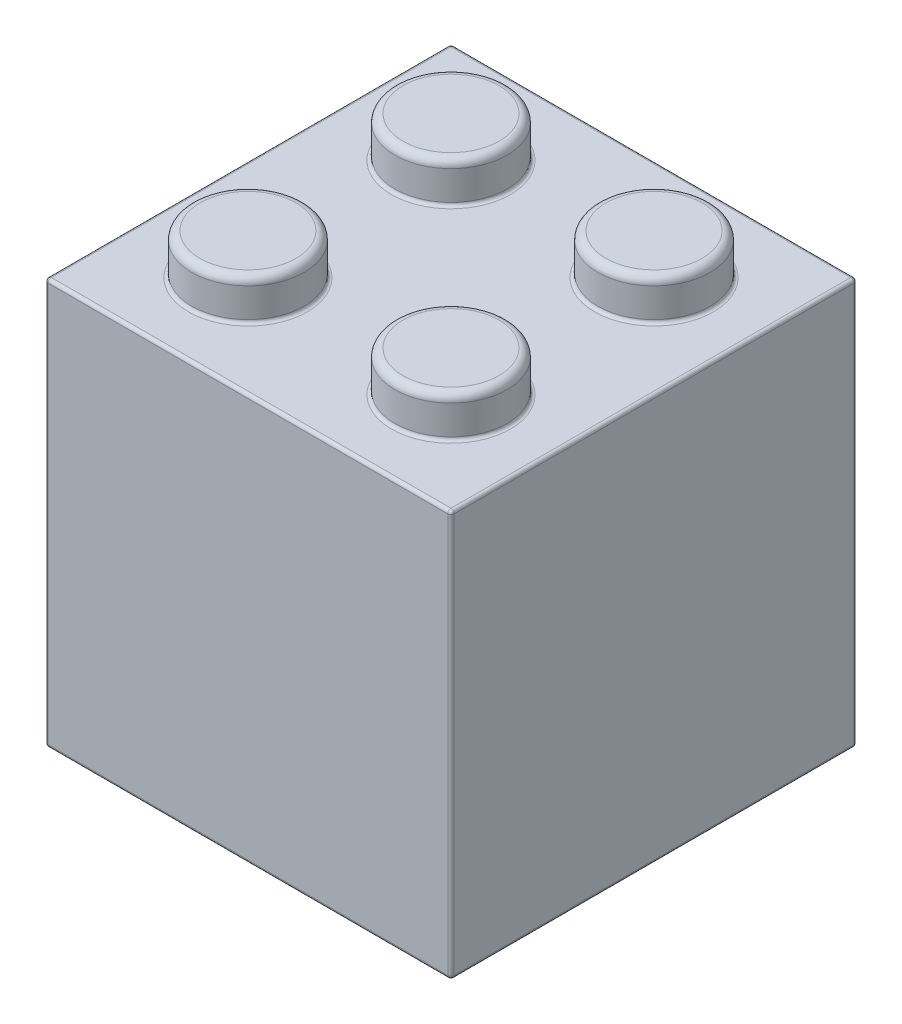
from build123d import *

# Parameters (mm, degrees)
SKETCH1_W           = 10
SKETCH1_H           = 10
BOX_DEPTH           = 10
SKETCH2_W           = 9
SKETCH2_H           = 9
CUT_EXTRUDE1_DEPTH  = 9.5
SKETCH3_R           = 1.384081264
PINS_DEPTH          = 1
SKETCH4_R           = 2.151452642
BOSS_EXTRUDE3_DEPTH = 9.45482151
SKETCH5_R           = 1.8
CUT_EXTRUDE2_DEPTH  = 9.5
SKETCH6_R           = 1.086370505
CUT_EXTRUDE3_DEPTH  = 1
BOSS_EXTRUDE4_DEPTH = 9.5
FILLET5_R           = 0.2
FILLET6_R           = 0.08


with BuildPart() as part:
    # Sketch1 → box (new body)
    with BuildSketch(Plane(origin=(0, 0, 0), x_dir=(1, 0, 0), z_dir=(0, 1, 0))):
        with Locations((-3.342652458, 0.57322318)):
            Rectangle(SKETCH1_W, SKETCH1_H)
    extrude(amount=BOX_DEPTH)

    # Sketch2 → Cut-Extrude1 (cut)
    with BuildSketch(Plane.XZ):
        with Locations((-3.342652458, -0.57322318)):
            Rectangle(SKETCH2_W, SKETCH2_H)
    extrude(amount=-CUT_EXTRUDE1_DEPTH, mode=Mode.SUBTRACT)

    # Sketch3 → pins (add)
    with BuildSketch(Plane(origin=(0, 10, 0), x_dir=(1, 0, 0), z_dir=(0, 1, 0))):
        with Locations(Location((-5.842652458, 3.07322318, 0), (0, 0, 270))):
            Circle(SKETCH3_R)
        with Locations(Location((-0.842652458, 3.07322318, 0), (0, 0, 270))):
            Circle(SKETCH3_R)
        with Locations(Location((-0.842652458, -1.92677682, 0), (0, 0, 270))):
            Circle(SKETCH3_R)
        with Locations(Location((-5.842652458, -1.92677682, 0), (0, 0, 270))):
            Circle(SKETCH3_R)
    extrude(amount=PINS_DEPTH)

    # Sketch4 → Boss-Extrude3 (add)
    with BuildSketch(Plane.XZ.offset(-9.5)):
        with Locations(Location((-3.342652458, -0.57322318, 0), (0, 0, 270))):
            Circle(SKETCH4_R)
    extrude(amount=BOSS_EXTRUDE3_DEPTH)

    # Sketch5 → Cut-Extrude2 (cut)
    with BuildSketch(Plane.XZ.offset(-0.04517849)):
        with Locations(Location((-3.342652458, -0.57322318, 0), (0, 0, 270))):
            Circle(SKETCH5_R)
    extrude(amount=-CUT_EXTRUDE2_DEPTH, mode=Mode.SUBTRACT)

    # Sketch6 → Cut-Extrude3 (cut)
    with BuildSketch(Plane.XZ.offset(-9.5)):
        with Locations(Location((-5.842652458, 1.92677682, 0), (0, 0, 270))):
            Circle(SKETCH6_R)
        with Locations(Location((-0.842652458, 1.92677682, 0), (0, 0, 270))):
            Circle(SKETCH6_R)
        with Locations(Location((-0.842652458, -3.07322318, 0), (0, 0, 270))):
            Circle(SKETCH6_R)
        with Locations(Location((-5.842652458, -3.07322318, 0), (0, 0, 270))):
            Circle(SKETCH6_R)
    extrude(amount=-CUT_EXTRUDE3_DEPTH, mode=Mode.SUBTRACT)

    # Sketch8 → Boss-Extrude4 (add)
    with BuildSketch(Plane.XZ.offset(-9.5)):
        with BuildLine():
            Line((-6.026662526, 3.92677682), (-5.15864239, 3.92677682))
            ThreePointArc((-5.15864239, 3.92677682), (-5.592652458, 3.492766752), (-6.026662526, 3.92677682))
        make_face()
        with BuildLine():
            Line((-7.842652458, 2.110786889), (-7.842652458, 1.242766752))
            ThreePointArc((-7.842652458, 1.242766752), (-7.40864239, 1.67677682), (-7.842652458, 2.110786889))
        make_face()
        with BuildLine():
            Line((-0.65864239, -5.07322318), (-1.526662526, -5.07322318))
            ThreePointArc((-1.526662526, -5.07322318), (-1.092652458, -4.639213111), (-0.65864239, -5.07322318))
        make_face()
        with BuildLine():
            Line((1.157347542, -3.257233248), (1.157347542, -2.389213111))
            ThreePointArc((1.157347542, -2.389213111), (0.723337474, -2.82322318), (1.157347542, -3.257233248))
        make_face()
        with BuildLine():
            Line((-6.026662526, -5.07322318), (-5.15864239, -5.07322318))
            ThreePointArc((-5.15864239, -5.07322318), (-5.592652458, -4.639213111), (-6.026662526, -5.07322318))
        make_face()
        with BuildLine():
            Line((-7.842652458, -3.257233248), (-7.842652458, -2.389213111))
            ThreePointArc((-7.842652458, -2.389213111), (-7.40864239, -2.82322318), (-7.842652458, -3.257233248))
        make_face()
        with BuildLine():
            Line((1.157347542, 2.110786889), (1.157347542, 1.242766752))
            ThreePointArc((1.157347542, 1.242766752), (0.723337474, 1.67677682), (1.157347542, 2.110786889))
        make_face()
        with BuildLine():
            Line((-0.65864239, 3.92677682), (-1.526662526, 3.92677682))
            ThreePointArc((-1.526662526, 3.92677682), (-1.092652458, 3.492766752), (-0.65864239, 3.92677682))
        make_face()
    extrude(amount=BOSS_EXTRUDE4_DEPTH)

    # Fillet5
    fillet5_edges = [part.edges().sort_by_distance(p)[0] for p in [
        (-5.842652458, 11, -4.457304443),
        (-0.842652458, 11, -4.457304443),
        (-0.842652458, 11, 0.542695557),
        (-5.842652458, 11, 0.542695557),
    ]]
    fillet(fillet5_edges, radius=FILLET5_R)

    # Fillet6
    fillet6_edges = [part.edges().sort_by_distance(p)[0] for p in [
        (1.657347542, 10, -0.57322318),
        (-7.842652458, 0, -4.165228214),
        (-7.40864239, 0, -2.82322318),
        (1.157347542, 0, 3.018781854),
        (0.723337474, 0, 1.67677682),
        (-3.342652458, 0, 3.92677682),
        (-1.092652458, 0, 3.492766752),
        (-3.342652458, 10, -5.57322318),
        (0.249352576, 0, 3.92677682),
        (-7.842652458, 0, 3.018781854),
        (-6.934657492, 0, -5.07322318),
        (1.157347542, 0, -4.165228214),
        (-5.842652458, 10, -4.457304443),
        (-0.842652458, 10, -4.457304443),
        (-0.842652458, 10, 0.542695557),
        (-5.842652458, 10, 0.542695557),
        (-8.342652458, 10, -0.57322318),
        (-3.342652458, 0.04517849, 1.578229463),
        (-3.342652458, 0, -5.57322318),
        (-3.342652458, 0.04517849, 1.22677682),
        (1.657347542, 0, -0.57322318),
        (-3.342652458, 0, 4.42677682),
        (-8.342652458, 0, -0.57322318),
        (-6.934657492, 0, 3.92677682),
        (-5.592652458, 0, 3.492766752),
        (-3.342652458, 10, 4.42677682),
        (-7.842652458, 0, -0.57322318),
        (-8.342652458, 5, -5.57322318),
        (1.657347542, 5, -5.57322318),
        (-7.40864239, 0, 1.67677682),
        (1.657347542, 5, 4.42677682),
        (-8.342652458, 5, 4.42677682),
        (0.249352576, 0, -5.07322318),
        (-1.092652458, 0, -4.639213111),
        (1.157347542, 0, -0.57322318),
        (0.723337474, 0, -2.82322318),
        (-3.342652458, 0, -5.07322318),
        (-5.592652458, 0, -4.639213111),
    ]]
    fillet(fillet6_edges, radius=FILLET6_R)


solid = part.part
